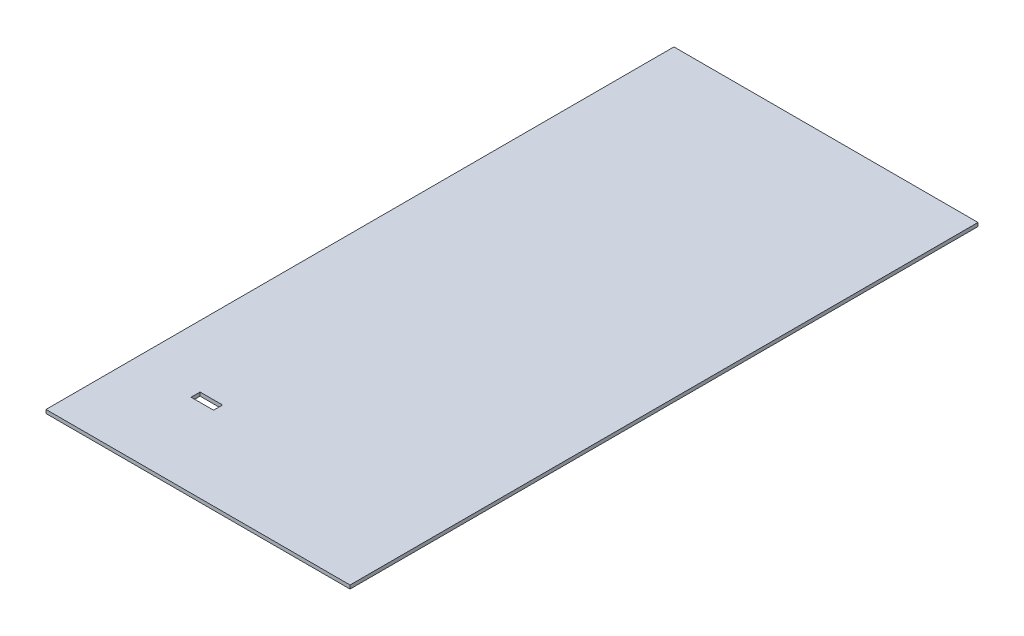
from build123d import *

# Parameters (mm, degrees)
SKETCH1_W           = 270
SKETCH1_H           = 557.6
BOSS_EXTRUDE1_DEPTH = 3.175
SKETCH2_W           = 20
SKETCH2_H           = 8
CUT_EXTRUDE1_DEPTH  = 310.78140781


with BuildPart() as part:
    # Sketch1 → Boss-Extrude1 (new body)
    with BuildSketch(Plane(origin=(0, 0, 0), x_dir=(1, 0, 0), z_dir=(0, 1, 0))):
        Rectangle(SKETCH1_W, SKETCH1_H)
    extrude(amount=BOSS_EXTRUDE1_DEPTH)

    # Sketch2 → Cut-Extrude1 (cut, through all)
    with BuildSketch(Plane(origin=(0, 3.175, 0), x_dir=(1, 0, 0), z_dir=(0, 1, 0))):
        with Locations((-70, -201)):
            Rectangle(SKETCH2_W, SKETCH2_H)
    extrude(amount=-CUT_EXTRUDE1_DEPTH, mode=Mode.SUBTRACT)


solid = part.part
